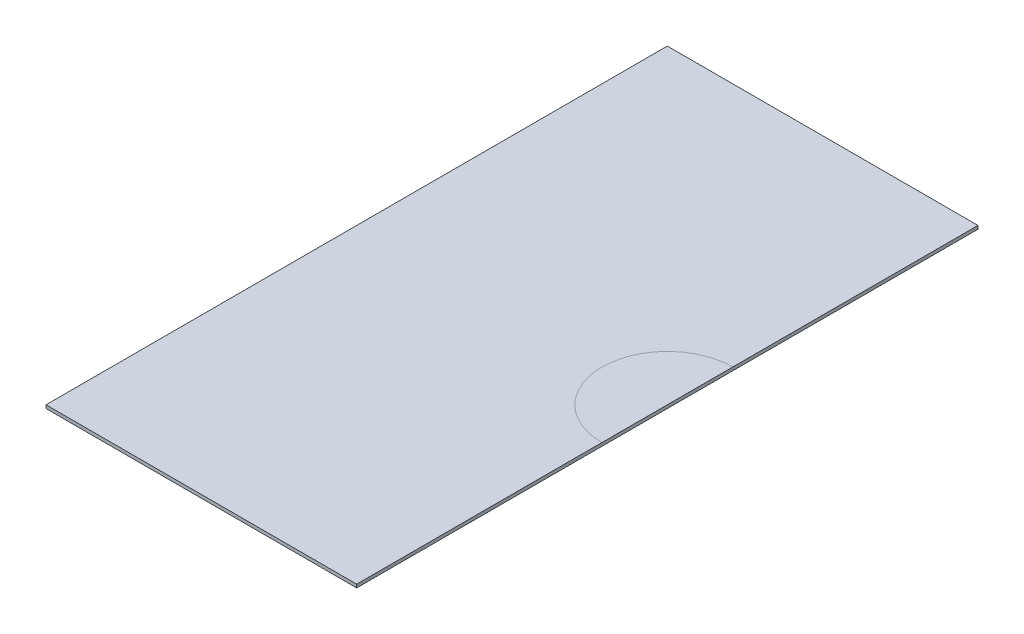
from build123d import *

# Parameters (mm, degrees)
SKETCH1_W           = 94.999999992
SKETCH1_H           = 189.999999984
BOSS_EXTRUDE1_DEPTH = 0.5


with BuildPart() as part:
    # Sketch1 → Boss-Extrude1 (new, symmetric)
    with BuildSketch(Plane(origin=(0, 0, 0), x_dir=(1, 0, 0), z_dir=(0, 1, 0))):
        Rectangle(SKETCH1_W, SKETCH1_H)
    extrude(amount=BOSS_EXTRUDE1_DEPTH, both=True)


solid = part.part
